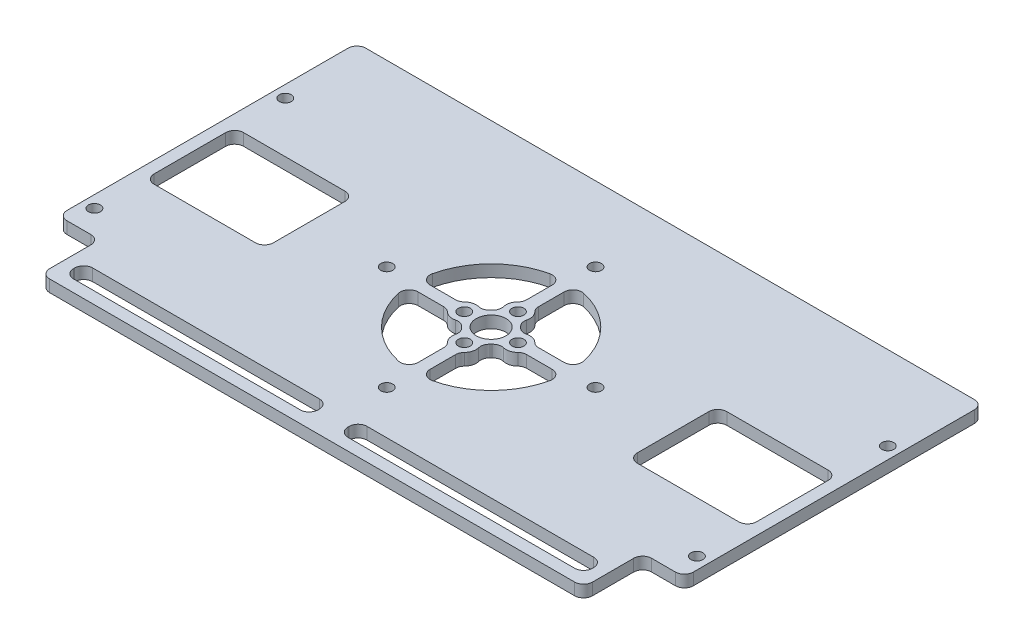
from build123d import *

# Parameters (mm, degrees)
SKETCH2_R           = 1
SKETCH2_W           = 41
SKETCH2_H           = 3.2
SKETCH2_W_2         = 20
SKETCH2_H_2         = 15
SKETCH2_R_2         = 2.5
BOSS_EXTRUDE1_DEPTH = 2
FILLET1_R           = 1.5


with BuildPart() as part:
    # Sketch2 → Boss-Extrude1 (new body)
    with BuildSketch(Plane(origin=(0, 0, 0), x_dir=(1, 0, 0), z_dir=(0, 1, 0))):
        Polygon((105, 0), (0, 0), (0, -50.1), (7, -50.1), (7, -60), (98, -60), (98, -50.1), (105, -50.1), align=None)
        with Locations(Location((2, -46, 0), (0, 0, 270))):
            Circle(SKETCH2_R, mode=Mode.SUBTRACT)
        with Locations((29.5, -56.4)):
            Rectangle(SKETCH2_W, SKETCH2_H, mode=Mode.SUBTRACT)
        with Locations((12, -30)):
            Rectangle(SKETCH2_W_2, SKETCH2_H_2, mode=Mode.SUBTRACT)
        with Locations(Location((35, -30, 0), (0, 0, 270))):
            Circle(SKETCH2_R, mode=Mode.SUBTRACT)
        with BuildLine():
            Line((51.5, -36.232050808), (51.5, -42.961481397))
            ThreePointArc((51.5, -42.961481397), (43.307611845, -39.192388155), (39.538518603, -31))
            Line((39.538518603, -31), (46.267949192, -31))
            ThreePointArc((46.267949192, -31), (47.68386163, -31.974856079), (49.333333333, -31.490711985))
            ThreePointArc((49.333333333, -31.490711985), (50.025126266, -32.474873734), (51.009288015, -33.166666667))
            ThreePointArc((51.009288015, -33.166666667), (50.525143921, -34.81613837), (51.5, -36.232050808))
        make_face(mode=Mode.SUBTRACT)
        with Locations((75.5, -56.4)):
            Rectangle(SKETCH2_W, SKETCH2_H, mode=Mode.SUBTRACT)
        with Locations(Location((52.5, -47.5, 0), (0, 0, 270))):
            Circle(SKETCH2_R, mode=Mode.SUBTRACT)
        with Locations(Location((103, -46, 0), (0, 0, 270))):
            Circle(SKETCH2_R, mode=Mode.SUBTRACT)
        with Locations(Location((52.5, -34.5, 0), (0, 0, 270))):
            Circle(SKETCH2_R, mode=Mode.SUBTRACT)
        with BuildLine():
            Line((58.732050808, -31), (65.461481397, -31))
            ThreePointArc((65.461481397, -31), (61.692388155, -39.192388155), (53.5, -42.961481397))
            Line((53.5, -42.961481397), (53.5, -36.232050808))
            ThreePointArc((53.5, -36.232050808), (54.474856079, -34.81613837), (53.990711985, -33.166666667))
            ThreePointArc((53.990711985, -33.166666667), (54.974873734, -32.474873734), (55.666666667, -31.490711985))
            ThreePointArc((55.666666667, -31.490711985), (57.31613837, -31.974856079), (58.732050808, -31))
        make_face(mode=Mode.SUBTRACT)
        with Locations((93, -30)):
            Rectangle(SKETCH2_W_2, SKETCH2_H_2, mode=Mode.SUBTRACT)
        with Locations(Location((48, -30, 0), (0, 0, 270))):
            Circle(SKETCH2_R, mode=Mode.SUBTRACT)
        with BuildLine():
            ThreePointArc((39.538518603, -29), (43.307611845, -20.807611845), (51.5, -17.038518603))
            Line((51.5, -17.038518603), (51.5, -23.767949192))
            ThreePointArc((51.5, -23.767949192), (50.525143921, -25.18386163), (51.009288015, -26.833333333))
            ThreePointArc((51.009288015, -26.833333333), (50.025126266, -27.525126266), (49.333333333, -28.509288015))
            ThreePointArc((49.333333333, -28.509288015), (47.68386163, -28.025143921), (46.267949192, -29))
            Line((46.267949192, -29), (39.538518603, -29))
        make_face(mode=Mode.SUBTRACT)
        with Locations(Location((2, -14, 0), (0, 0, 270))):
            Circle(SKETCH2_R, mode=Mode.SUBTRACT)
        with Locations(Location((52.5, -30, 0), (0, 0, 270))):
            Circle(SKETCH2_R_2, mode=Mode.SUBTRACT)
        with Locations(Location((57, -30, 0), (0, 0, 270))):
            Circle(SKETCH2_R, mode=Mode.SUBTRACT)
        with Locations(Location((52.5, -25.5, 0), (0, 0, 270))):
            Circle(SKETCH2_R, mode=Mode.SUBTRACT)
        with BuildLine():
            Line((53.5, -23.767949192), (53.5, -17.038518603))
            ThreePointArc((53.5, -17.038518603), (61.692388155, -20.807611845), (65.461481397, -29))
            Line((65.461481397, -29), (58.732050808, -29))
            ThreePointArc((58.732050808, -29), (57.31613837, -28.025143921), (55.666666667, -28.509288015))
            ThreePointArc((55.666666667, -28.509288015), (54.974873734, -27.525126266), (53.990711985, -26.833333333))
            ThreePointArc((53.990711985, -26.833333333), (54.474856079, -25.18386163), (53.5, -23.767949192))
        make_face(mode=Mode.SUBTRACT)
        with Locations(Location((70, -30, 0), (0, 0, 270))):
            Circle(SKETCH2_R, mode=Mode.SUBTRACT)
        with Locations(Location((52.5, -12.5, 0), (0, 0, 270))):
            Circle(SKETCH2_R, mode=Mode.SUBTRACT)
        with Locations(Location((103, -14, 0), (0, 0, 270))):
            Circle(SKETCH2_R, mode=Mode.SUBTRACT)
    extrude(amount=BOSS_EXTRUDE1_DEPTH)

    # Fillet1
    fillet1_edges = [part.edges().sort_by_distance(p)[0] for p in [
        (51.5, 1, 17.038518603),
        (39.538518603, 1, 29),
        (46.267949192, 1, 29),
        (49.333333333, 1, 28.509288015),
        (51.009288015, 1, 26.833333333),
        (51.5, 1, 23.767949192),
        (2, 1, 22.5),
        (2, 1, 37.5),
        (22, 1, 37.5),
        (22, 1, 22.5),
        (9, 1, 54.8),
        (9, 1, 58),
        (50, 1, 58),
        (50, 1, 54.8),
        (55, 1, 54.8),
        (55, 1, 58),
        (96, 1, 58),
        (96, 1, 54.8),
        (98, 1, 50.1),
        (98, 1, 60),
        (7, 1, 60),
        (7, 1, 50.1),
        (0, 1, 50.1),
        (0, 1, 0),
        (105, 1, 0),
        (105, 1, 50.1),
        (83, 1, 22.5),
        (83, 1, 37.5),
        (103, 1, 37.5),
        (103, 1, 22.5),
        (51.5, 1, 42.961481397),
        (51.5, 1, 36.232050808),
        (51.009288015, 1, 33.166666667),
        (49.333333333, 1, 31.490711985),
        (46.267949192, 1, 31),
        (39.538518603, 1, 31),
        (53.5, 1, 17.038518603),
        (53.5, 1, 23.767949192),
        (53.990711985, 1, 26.833333333),
        (55.666666667, 1, 28.509288015),
        (58.732050808, 1, 29),
        (65.461481397, 1, 29),
        (65.461481397, 1, 31),
        (58.732050808, 1, 31),
        (55.666666667, 1, 31.490711985),
        (53.990711985, 1, 33.166666667),
        (53.5, 1, 36.232050808),
        (53.5, 1, 42.961481397),
    ]]
    fillet(fillet1_edges, radius=FILLET1_R)


solid = part.part
